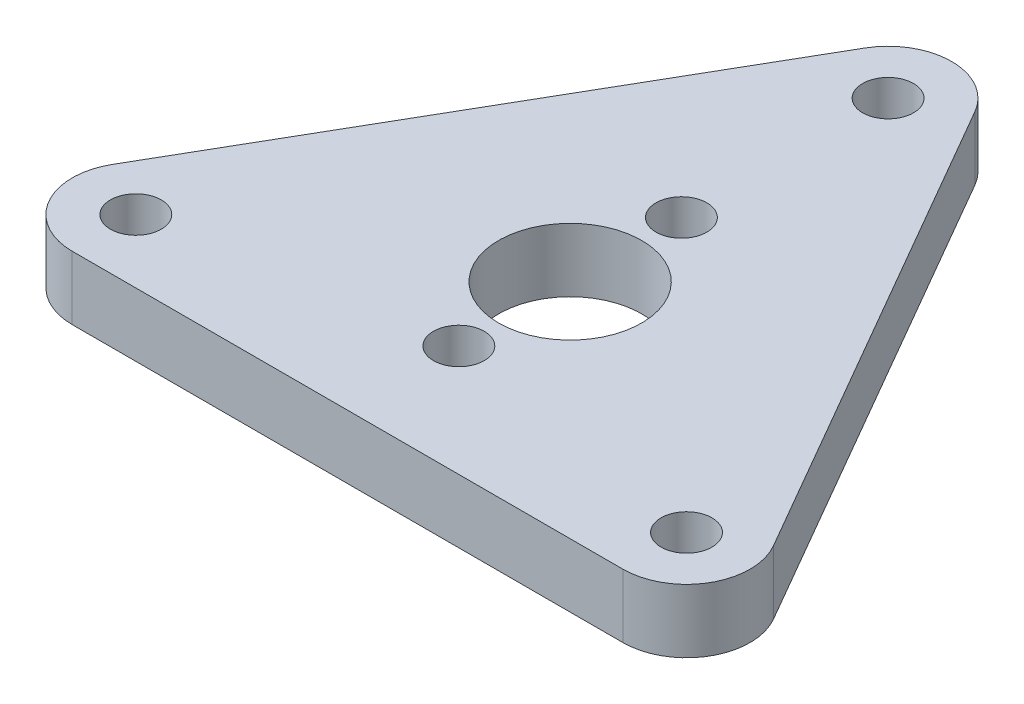
from build123d import *

# Parameters (mm, degrees)
SKETCH_2_R      = 1.6
SKETCH_2_R_2    = 4.5
EXTRUDE_1_DEPTH = 2


with BuildPart() as part:
    # 草图2 → 凸台-拉伸1 (new, symmetric)
    with BuildSketch(Plane(origin=(0, 0, 0), x_dir=(1, 0, 0), z_dir=(0, 1, 0))):
        with BuildLine():
            Line((-3.464101615, 22), (-20.784609691, -8))
            ThreePointArc((-20.784609691, -8), (-20.784609691, -12), (-17.320508076, -14))
            Line((-17.320508076, -14), (17.320508076, -14))
            ThreePointArc((17.320508076, -14), (20.784609691, -12), (20.784609691, -8))
            Line((20.784609691, -8), (3.464101615, 22))
            ThreePointArc((3.464101615, 22), (0, 24), (-3.464101615, 22))
        make_face()
        with Locations(Location((0, 7, 0), (0, 0, 270))):
            Circle(SKETCH_2_R, mode=Mode.SUBTRACT)
        with Locations(Location((0, -7, 0), (0, 0, 270))):
            Circle(SKETCH_2_R, mode=Mode.SUBTRACT)
        with Locations(Location((0, 20, 0), (0, 0, 270))):
            Circle(SKETCH_2_R, mode=Mode.SUBTRACT)
        with Locations(Location((17.320508076, -10, 0), (0, 0, 270))):
            Circle(SKETCH_2_R, mode=Mode.SUBTRACT)
        with Locations(Location((-17.320508076, -10, 0), (0, 0, 270))):
            Circle(SKETCH_2_R, mode=Mode.SUBTRACT)
        with Locations(Location((0, 0, 0), (0, 0, 270))):
            Circle(SKETCH_2_R_2, mode=Mode.SUBTRACT)
    extrude(amount=EXTRUDE_1_DEPTH, both=True)


solid = part.part
